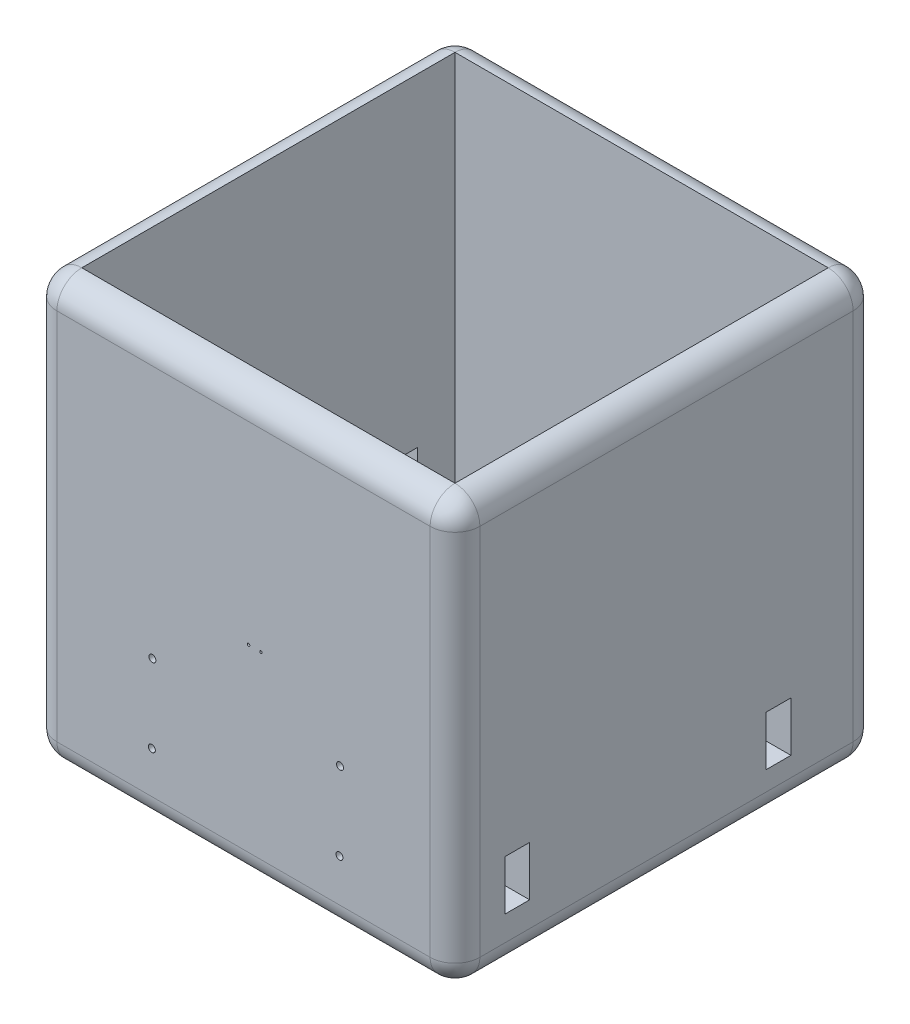
from build123d import *

# Parameters (mm, degrees)
SKETCH1_W           = 170
SKETCH1_H           = 170
BOSS_EXTRUDE2_DEPTH = 170
FILLET5_R           = 10
SKETCH6_W           = 150
SKETCH6_H           = 150
CUT_EXTRUDE2_DEPTH  = 165
SKETCH7_R           = 25
CUT_EXTRUDE3_DEPTH  = 5
SKETCH8_R           = 0.5
CUT_EXTRUDE4_DEPTH  = 5
SKETCH9_R           = 7.5
CUT_EXTRUDE5_DEPTH  = 5
SKETCH10_R          = 1.4
CUT_EXTRUDE8_DEPTH  = 5
SKETCH19_W          = 10
SKETCH19_H          = 20
CUT_EXTRUDE12_DEPTH = 15
SKETCH14_W          = 10
SKETCH14_H          = 20
CUT_EXTRUDE15_DEPTH = 15
SKETCH14_5_W        = 10
SKETCH14_5_H        = 20
CUT_EXTRUDE16_DEPTH = 15


with BuildPart() as part:
    # Sketch1 → Boss-Extrude2 (new body)
    with BuildSketch(Plane.XY):
        with Locations((85, 85)):
            Rectangle(SKETCH1_W, SKETCH1_H)
    extrude(amount=BOSS_EXTRUDE2_DEPTH)

    # Fillet5
    fillet5_edges = [part.edges().sort_by_distance(p)[0] for p in [
        (170, 170, 85),
        (85, 170, 0),
        (0, 85, 0),
        (170, 85, 0),
        (85, 0, 0),
        (170, 0, 85),
        (170, 85, 170),
        (85, 170, 170),
        (0, 170, 85),
        (0, 0, 85),
        (85, 0, 170),
        (0, 85, 170),
    ]]
    fillet(fillet5_edges, radius=FILLET5_R)

    # Sketch6 → Cut-Extrude2 (cut)
    with BuildSketch(Plane(origin=(0, 170, 0), x_dir=(1, 0, 0), z_dir=(0, 1, 0))):
        with Locations((85, -85)):
            Rectangle(SKETCH6_W, SKETCH6_H)
    extrude(amount=-CUT_EXTRUDE2_DEPTH, mode=Mode.SUBTRACT)

    # Sketch7 → Cut-Extrude3 (cut)
    with BuildSketch(Plane(origin=(0, 0, 0), x_dir=(-1, 0, 0), z_dir=(0, -1, 0))):
        with Locations((-49.635709215, -128.113207768)):
            Circle(SKETCH7_R)
    extrude(amount=-CUT_EXTRUDE3_DEPTH, mode=Mode.SUBTRACT)

    # Sketch8 → Cut-Extrude4 (cut)
    with BuildSketch(Plane.XY.offset(170)):
        with Locations((87.027102924, 82.292149715)):
            Circle(SKETCH8_R)
        with Locations((92.027102924, 82.259165374)):
            Circle(SKETCH8_R)
    extrude(amount=-CUT_EXTRUDE4_DEPTH, mode=Mode.SUBTRACT)

    # Sketch9 → Cut-Extrude5 (cut)
    with BuildSketch(Plane(origin=(0, 0, 0), x_dir=(-1, 0, 0), z_dir=(0, -1, 0))):
        with Locations((-135.371528781, -22.567188871)):
            Circle(SKETCH9_R)
    extrude(amount=-CUT_EXTRUDE5_DEPTH, mode=Mode.SUBTRACT)

    # Sketch10 → Cut-Extrude8 (cut)
    with BuildSketch(Plane.XY.offset(170)):
        with Locations((48.382145487, 58.196404185)):
            Circle(SKETCH10_R)
        with Locations((123.782145487, 58.455011456)):
            Circle(SKETCH10_R)
        with Locations((48.166639428, 26.796404185)):
            Circle(SKETCH10_R)
        with Locations((123.566639428, 27.055011456)):
            Circle(SKETCH10_R)
    extrude(amount=-CUT_EXTRUDE8_DEPTH, mode=Mode.SUBTRACT)

    # Sketch19 → Cut-Extrude12 (cut)
    with BuildSketch(Plane(origin=(170, 0, 0), x_dir=(0, 0, -1), z_dir=(1, 0, 0))):
        with Locations((-40, 27.793299749)):
            Rectangle(SKETCH19_W, SKETCH19_H)
        with Locations((-145, 30)):
            Rectangle(SKETCH19_W, SKETCH19_H)
    extrude(amount=-CUT_EXTRUDE12_DEPTH, mode=Mode.SUBTRACT)

    # Sketch14 → Cut-Extrude15 (cut)
    with BuildSketch(Plane.ZY):
        with Locations((30, 30)):
            Rectangle(SKETCH14_W, SKETCH14_H)
    extrude(amount=-CUT_EXTRUDE15_DEPTH, mode=Mode.SUBTRACT)

    # Sketch14<5> → Cut-Extrude16 (cut)
    with BuildSketch(Plane.ZY):
        with Locations((30, 30)):
            Rectangle(SKETCH14_5_W, SKETCH14_5_H)
        with Locations((145, 30)):
            Rectangle(SKETCH14_5_W, SKETCH14_5_H)
    extrude(amount=-CUT_EXTRUDE16_DEPTH, mode=Mode.SUBTRACT)


solid = part.part
